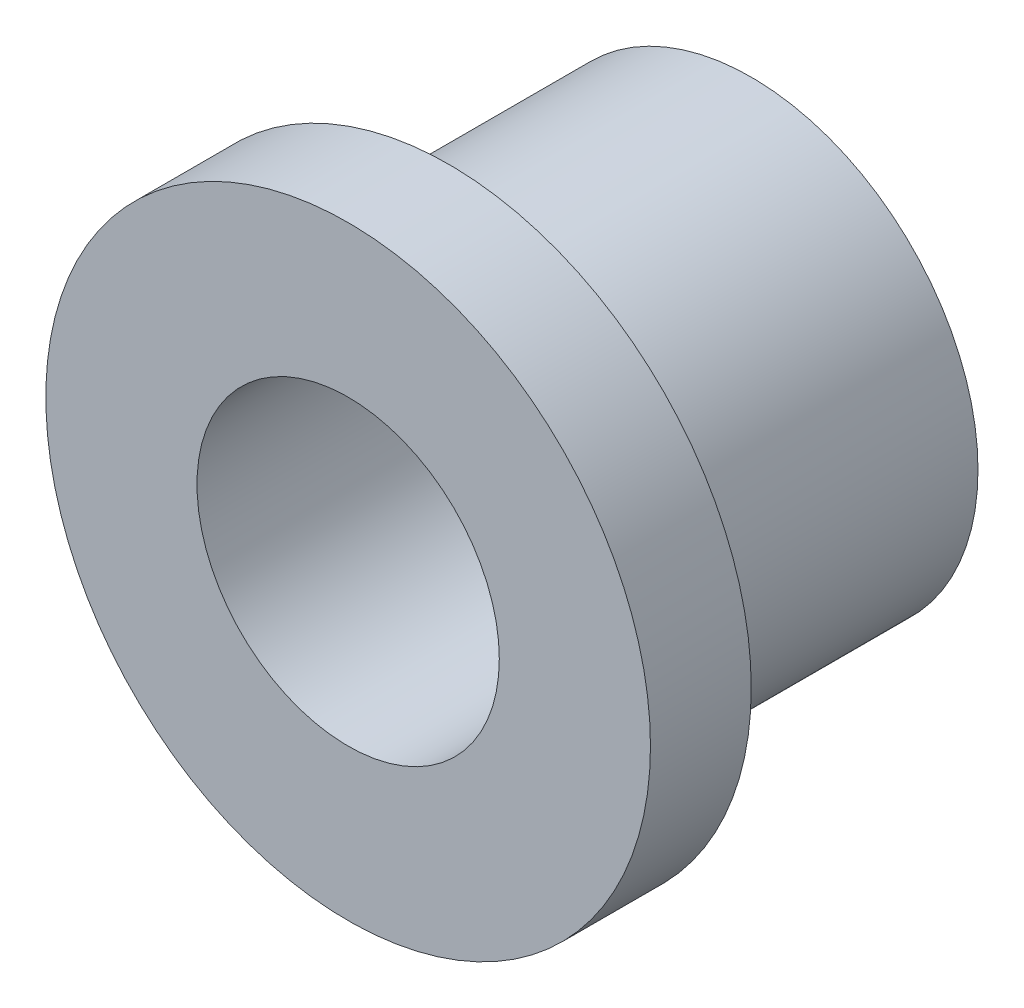
from build123d import *

# Parameters (mm, degrees)
SKETCH1_R           = 4.5
SKETCH1_R_2         = 3
BOSS_EXTRUDE1_DEPTH = 8
BOSS_EXTRUDE2_START = -2
SKETCH2_R           = 6
SKETCH2_R_2         = 4.5
BOSS_EXTRUDE2_DEPTH = 2


with BuildPart() as part:
    # Sketch1 → Boss-Extrude1 (new body)
    with BuildSketch(Plane.XY):
        Circle(SKETCH1_R)
        Circle(SKETCH1_R_2, mode=Mode.SUBTRACT)
    extrude(amount=BOSS_EXTRUDE1_DEPTH)

    # Sketch2 → Boss-Extrude2 (add)
    with BuildSketch(Plane.XY.offset(8).offset(BOSS_EXTRUDE2_START)):
        Circle(SKETCH2_R)
        Circle(SKETCH2_R_2, mode=Mode.SUBTRACT)
    extrude(amount=BOSS_EXTRUDE2_DEPTH)


solid = part.part
